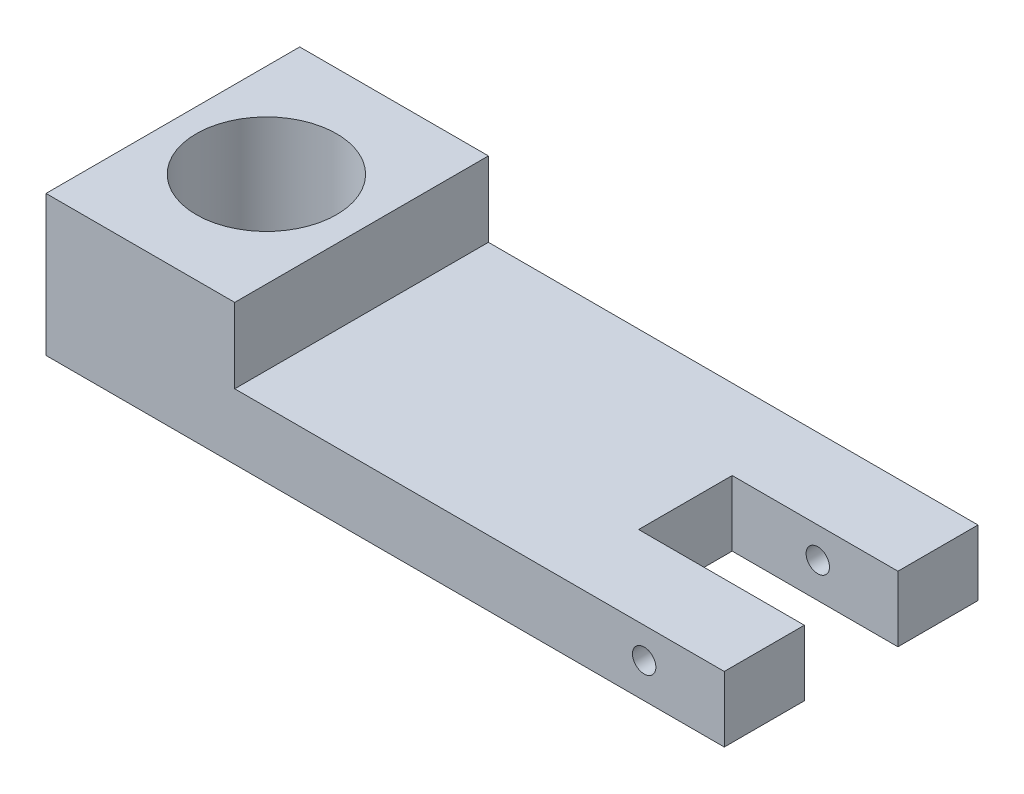
from build123d import *

# Parameters (mm, degrees)
SKETCH_1_W          = 145
SKETCH_1_H          = 54.239140964
SKETCH_1_R          = 15
EXTRUDE_1_DEPTH     = 14
SKETCH_2_W          = 40.973545211
SKETCH_2_H          = 20
CUT_EXTRUDE_1_DEPTH = 50
SKETCH_3_R          = 2.5
CUT_EXTRUDE_2_DEPTH = 36
SKETCH_4_W          = 40.34248958
SKETCH_4_H          = 54.239140964
SKETCH_4_R          = 15
EXTRUDE_2_DEPTH     = 16


with BuildPart() as part:
    # Эскиз1 → Вытянуть1 (new body)
    with BuildSketch(Plane(origin=(0, 0, 0), x_dir=(1, 0, 0), z_dir=(0, 1, 0))):
        with Locations((52.5, 0)):
            Rectangle(SKETCH_1_W, SKETCH_1_H)
        with Locations(Location((0, 0, 0), (0, 0, 270))):
            Circle(SKETCH_1_R, mode=Mode.SUBTRACT)
    extrude(amount=EXTRUDE_1_DEPTH)

    # Эскиз2 → Вырез-Вытянуть1 (cut)
    with BuildSketch(Plane(origin=(0, 0, 0), x_dir=(1, 0, 0), z_dir=(0, 1, 0))):
        with Locations((110.055787262, 0)):
            Rectangle(SKETCH_2_W, SKETCH_2_H)
    extrude(amount=CUT_EXTRUDE_1_DEPTH, mode=Mode.SUBTRACT)

    # Эскиз3 → Вырез-Вытянуть2 (cut, symmetric)
    with BuildSketch(Plane.XY):
        with Locations(Location((107.871367235, 7.461129595, 0), (0, 0, 180))):
            Circle(SKETCH_3_R)
    extrude(amount=CUT_EXTRUDE_2_DEPTH, both=True, mode=Mode.SUBTRACT)

    # Эскиз4 → Вытянуть2 (add)
    with BuildSketch(Plane(origin=(0, 14, 0), x_dir=(1, 0, 0), z_dir=(0, 1, 0))):
        with Locations((0.17124479, 0)):
            Rectangle(SKETCH_4_W, SKETCH_4_H)
        with Locations(Location((0, 0, 0), (0, 0, 270))):
            Circle(SKETCH_4_R, mode=Mode.SUBTRACT)
    extrude(amount=EXTRUDE_2_DEPTH)


solid = part.part
